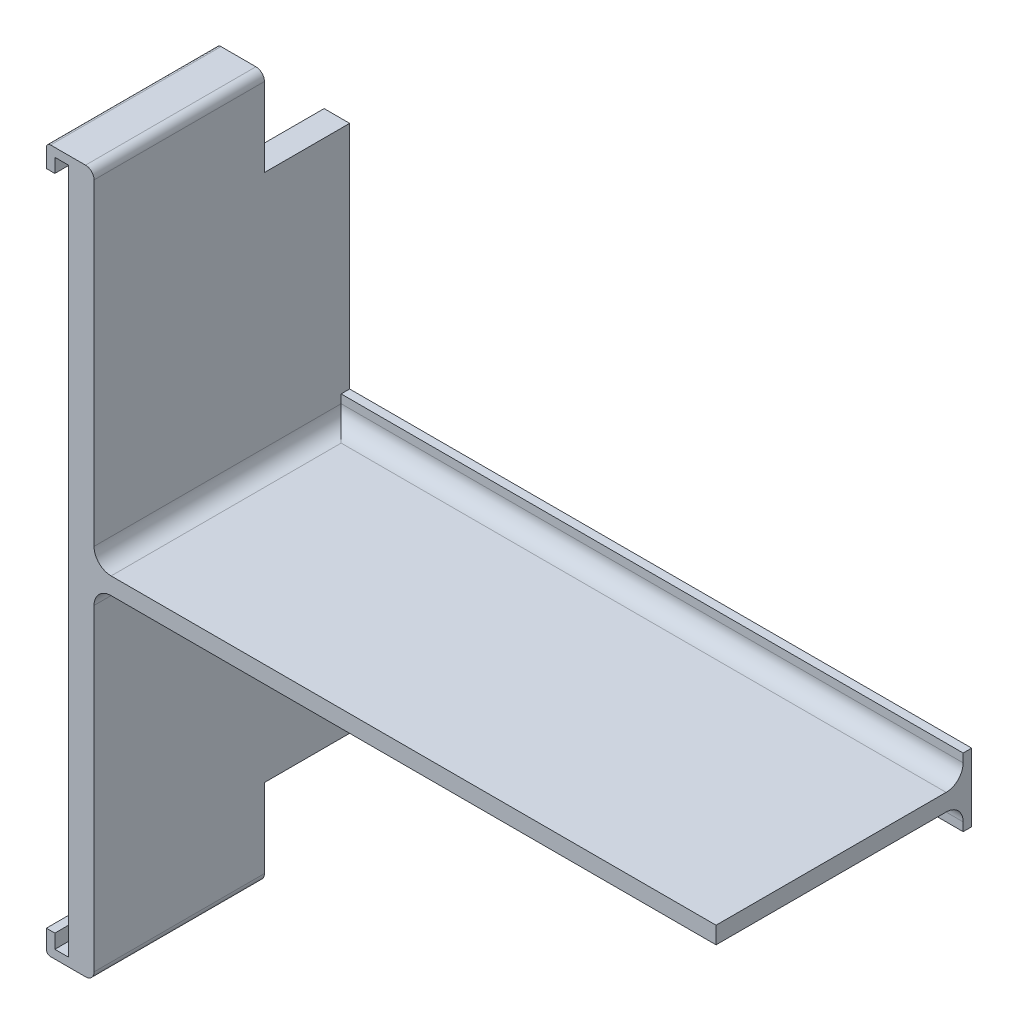
from build123d import *

# Parameters (mm, degrees)
BOSS_EXTRUDE1_DEPTH = 20
SKETCH3_W           = 76
SKETCH3_H           = 2
BOSS_EXTRUDE2_DEPTH = 30
FILLET2_R           = 1
FILLET3_R           = 0.5
SKETCH4_W           = 3
SKETCH4_H           = 62
BOSS_EXTRUDE3_DEPTH = 10
SKETCH5_W           = 76
SKETCH5_H           = 8
BOSS_EXTRUDE4_DEPTH = 1
FILLET5_R           = 2


with BuildPart() as part:
    # Sketch1 → Boss-Extrude1 (new body)
    with BuildSketch(Plane(origin=(0, 0, 0), x_dir=(0, 1, 0), z_dir=(0, 0, 1))):
        Polygon((-38.603475532, 1.8), (-41.25, 1.8), (-41.25, -3.8), (41.25, -3.8), (41.25, 1.8), (38.603475532, 1.8), (38.603475532, 0.8), (40.25, 0.8), (40.25, -0.8), (-38.603475532, -0.8), (-40.25, -0.8), (-40.25, 0.8), (-38.603475532, 0.8), align=None)
    extrude(amount=BOSS_EXTRUDE1_DEPTH)

    # Sketch3 → Boss-Extrude2 (add)
    with BuildSketch(Plane.XY.offset(20)):
        with Locations((38.8, 0)):
            Rectangle(SKETCH3_W, SKETCH3_H)
    extrude(amount=-BOSS_EXTRUDE2_DEPTH)

    # Fillet2
    fillet2_edges = [part.edges().sort_by_distance(p)[0] for p in [
        (3.8, 41.25, 10),
        (3.8, -41.25, 10),
    ]]
    fillet(fillet2_edges, radius=FILLET2_R)

    # Fillet3
    fillet3_edges = [part.edges().sort_by_distance(p)[0] for p in [
        (-1.8, 41.25, 10),
        (-1.8, -41.25, 10),
    ]]
    fillet(fillet3_edges, radius=FILLET3_R)

    # Sketch4 → Boss-Extrude3 (add)
    with BuildSketch(Plane(origin=(0, 0, 0), x_dir=(1, 0, 0), z_dir=(0, 0, -1))):
        with Locations((2.3, 0)):
            Rectangle(SKETCH4_W, SKETCH4_H)
    extrude(amount=BOSS_EXTRUDE3_DEPTH)

    # Sketch5 → Boss-Extrude4 (add)
    with BuildSketch(Plane(origin=(0, 0, -10), x_dir=(1, 0, 0), z_dir=(0, 0, -1))):
        with Locations((38.8, 0)):
            Rectangle(SKETCH5_W, SKETCH5_H)
    extrude(amount=-BOSS_EXTRUDE4_DEPTH)

    # Fillet5
    fillet5_edges = [part.edges().sort_by_distance(p)[0] for p in [
        (3.8, -1, 5.5),
        (40.3, 1, -9),
        (40.3, -1, -9),
        (3.8, 1, 5.5),
    ]]
    fillet(fillet5_edges, radius=FILLET5_R)


solid = part.part
